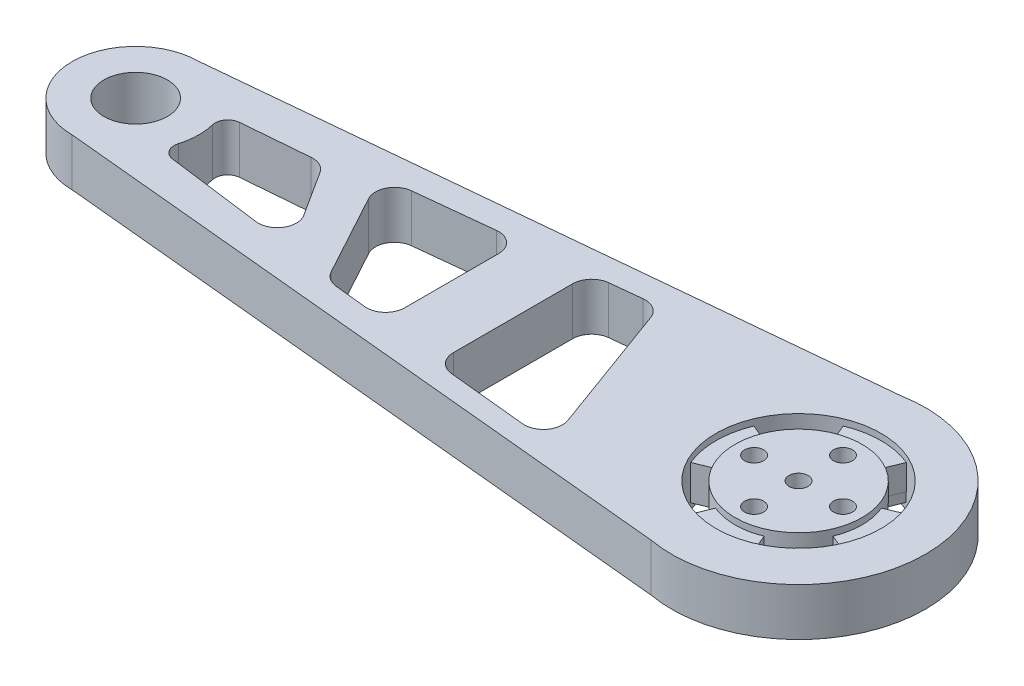
from build123d import *
from build123d.topology import SkipClean

# Parameters (mm, degrees)
EXTRUDE_1_DEPTH          = 47
EXTRUDE_1_DEPTH_BACK     = 57
EXTRUDE_2_DEPTH          = 3.75
EXTRUDE_2_DEPTH_BACK     = 3.75
SKETCH_2_R               = 20
CUT_EXTRUDE_1_DEPTH      = 3.75
CUT_EXTRUDE_1_DEPTH_BACK = 3.75
SKETCH_3_R               = 1.5
CUT_EXTRUDE_START        = -1
CUT_EXTRUDE_2_DEPTH      = 1
SKETCH_5_R               = 1.5
CUT_EXTRUDE_3_DEPTH      = 2.5
EXTRUDE_START            = 1.5
EXTRUDE_3_DEPTH          = 1.5
EXTRUDE_4_DEPTH          = 3.75
EXTRUDE_4_DEPTH_BACK     = 3.75
SKETCH_7_R               = 10
SKETCH_7_R_2             = 5
CUT_EXTRUDE_4_DEPTH      = 3.75
CUT_EXTRUDE_4_DEPTH_BACK = 3.75
SKETCH_8_R               = 5
EXTRUDE_5_DEPTH          = 3.75
EXTRUDE_5_DEPTH_BACK     = 3.75
CUT_EXTRUDE_5_DEPTH      = 3.75
CUT_EXTRUDE_5_DEPTH_BACK = 3.75


with BuildPart() as part:
    # 草图1 → 凸台-拉伸1 (new, two sides: drawn at the far end of the back side and taken through both)
    with BuildSketch(Plane(origin=(0, 0, 0), x_dir=(0, 0, -1), z_dir=(1, 0, 0)).offset(-EXTRUDE_1_DEPTH_BACK)):
        Polygon((10, 0), (10, 3.75), (-10, 3.75), (-10, -3.75), (10, -3.75), align=None)
    extrude(amount=EXTRUDE_1_DEPTH + EXTRUDE_1_DEPTH_BACK)

    # 草图2 → 凸台-拉伸2 (add, two sides: drawn at the far end of the back side and taken through both)
    with BuildSketch(Plane(origin=(0, 0, 0), x_dir=(1, 0, 0), z_dir=(0, 1, 0)).offset(-EXTRUDE_2_DEPTH_BACK)):
        with Locations((47.397956018, 0)):
            Circle(SKETCH_2_R)
    extrude(amount=EXTRUDE_2_DEPTH + EXTRUDE_2_DEPTH_BACK)

    # 草图3 → 切除-拉伸1 (cut, two sides: drawn at the far end of the back side and taken through both)
    with BuildSketch(Plane(origin=(0, 0, 0), x_dir=(1, 0, 0), z_dir=(0, 1, 0)).offset(-CUT_EXTRUDE_1_DEPTH_BACK)):
        with BuildLine():
            ThreePointArc((52.372840639, -12.010433923), (56.590344173, -9.192388155), (59.408389941, -4.974884621))
            Line((59.408389941, -4.974884621), (56.636751343, -3.826834324))
            ThreePointArc((56.636751343, -3.826834324), (54.46902383, -7.071067812), (51.224790342, -9.238795325))
            Line((51.224790342, -9.238795325), (52.372840639, -12.010433923))
        make_face()
        with BuildLine():
            ThreePointArc((35.387522095, -4.974884621), (38.205567863, -9.192388155), (42.423071397, -12.010433923))
            Line((42.423071397, -12.010433923), (43.571121694, -9.238795325))
            ThreePointArc((43.571121694, -9.238795325), (40.326888206, -7.071067812), (38.159160693, -3.826834324))
            Line((38.159160693, -3.826834324), (35.387522095, -4.974884621))
        make_face()
        with BuildLine():
            Line((56.636751343, 3.826834324), (59.408389941, 4.974884621))
            ThreePointArc((59.408389941, 4.974884621), (56.590344173, 9.192388155), (52.372840639, 12.010433923))
            Line((52.372840639, 12.010433923), (51.224790342, 9.238795325))
            ThreePointArc((51.224790342, 9.238795325), (54.46902383, 7.071067812), (56.636751343, 3.826834324))
        make_face()
        with BuildLine():
            ThreePointArc((42.423071397, 12.010433923), (38.205567863, 9.192388155), (35.387522095, 4.974884621))
            Line((35.387522095, 4.974884621), (38.159160693, 3.826834324))
            ThreePointArc((38.159160693, 3.826834324), (40.326888206, 7.071067812), (43.571121694, 9.238795325))
            Line((43.571121694, 9.238795325), (42.423071397, 12.010433923))
        make_face()
        with Locations((47.397956018, 7)):
            Circle(SKETCH_3_R)
        with Locations((47.397956018, 0)):
            Circle(SKETCH_3_R)
        with Locations((54.397956018, 0)):
            Circle(SKETCH_3_R)
        with Locations((47.397956018, -7)):
            Circle(SKETCH_3_R)
        with Locations((40.397956018, 0)):
            Circle(SKETCH_3_R)
    extrude(amount=CUT_EXTRUDE_1_DEPTH + CUT_EXTRUDE_1_DEPTH_BACK, mode=Mode.SUBTRACT)

    # 草图4 → 切除-拉伸2 (cut)
    with SkipClean():  # the faces are left unmerged after this step: merging them gives an invalid solid
        with BuildSketch(Plane(origin=(0, 3.75, 0), x_dir=(1, 0, 0), z_dir=(0, 1, 0)).offset(CUT_EXTRUDE_START)):
            with BuildLine():
                Line((43.571121694, 9.238795325), (42.423071397, 12.010433923))
                ThreePointArc((42.423071397, 12.010433923), (47.397956018, 13), (52.372840639, 12.010433923))
                Line((52.372840639, 12.010433923), (51.224790342, 9.238795325))
                ThreePointArc((51.224790342, 9.238795325), (47.397956018, 10), (43.571121694, 9.238795325))
            make_face()
            with BuildLine():
                Line((56.636751343, 3.826834324), (59.408389941, 4.974884621))
                ThreePointArc((59.408389941, 4.974884621), (60.397956018, 0), (59.408389941, -4.974884621))
                Line((59.408389941, -4.974884621), (56.636751343, -3.826834324))
                ThreePointArc((56.636751343, -3.826834324), (57.397956018, 0), (56.636751343, 3.826834324))
            make_face()
            with BuildLine():
                Line((51.224790342, -9.238795325), (52.372840639, -12.010433923))
                ThreePointArc((52.372840639, -12.010433923), (47.397956018, -13), (42.423071397, -12.010433923))
                Line((42.423071397, -12.010433923), (43.571121694, -9.238795325))
                ThreePointArc((43.571121694, -9.238795325), (47.397956018, -10), (51.224790342, -9.238795325))
            make_face()
            with BuildLine():
                Line((38.159160693, -3.826834324), (35.387522095, -4.974884621))
                ThreePointArc((35.387522095, -4.974884621), (34.397956018, 0), (35.387522095, 4.974884621))
                Line((35.387522095, 4.974884621), (38.159160693, 3.826834324))
                ThreePointArc((38.159160693, 3.826834324), (37.397956018, 0), (38.159160693, -3.826834324))
            make_face()
        extrude(amount=CUT_EXTRUDE_2_DEPTH, mode=Mode.SUBTRACT)

    # 草图5 → 切除-拉伸3 (cut)
    with SkipClean():  # the faces are left unmerged after this step: merging them gives an invalid solid
        with BuildSketch(Plane.XZ.offset(3.75)):
            with BuildLine():
                ThreePointArc((51.224790342, -9.238795325), (54.46902383, -7.071067812), (56.636751343, -3.826834324))
                Line((56.636751343, -3.826834324), (59.408389941, -4.974884621))
                ThreePointArc((59.408389941, -4.974884621), (60.397956018, 0), (59.408389941, 4.974884621))
                Line((59.408389941, 4.974884621), (56.636751343, 3.826834324))
                ThreePointArc((56.636751343, 3.826834324), (54.46902383, 7.071067812), (51.224790342, 9.238795325))
                Line((51.224790342, 9.238795325), (52.372840639, 12.010433923))
                ThreePointArc((52.372840639, 12.010433923), (47.397956018, 13), (42.423071397, 12.010433923))
                Line((42.423071397, 12.010433923), (43.571121694, 9.238795325))
                ThreePointArc((43.571121694, 9.238795325), (40.326888206, 7.071067812), (38.159160693, 3.826834324))
                Line((38.159160693, 3.826834324), (35.387522095, 4.974884621))
                ThreePointArc((35.387522095, 4.974884621), (34.397956018, 0), (35.387522095, -4.974884621))
                Line((35.387522095, -4.974884621), (38.159160693, -3.826834324))
                ThreePointArc((38.159160693, -3.826834324), (40.326888206, -7.071067812), (43.571121694, -9.238795325))
                Line((43.571121694, -9.238795325), (42.423071397, -12.010433923))
                ThreePointArc((42.423071397, -12.010433923), (47.397956018, -13), (52.372840639, -12.010433923))
                Line((52.372840639, -12.010433923), (51.224790342, -9.238795325))
            make_face()
            with Locations((47.397956018, -7)):
                Circle(SKETCH_5_R, mode=Mode.SUBTRACT)
            with Locations((54.397956018, 0)):
                Circle(SKETCH_5_R, mode=Mode.SUBTRACT)
            with Locations((40.397956018, 0)):
                Circle(SKETCH_5_R, mode=Mode.SUBTRACT)
            with Locations((47.397956018, 0)):
                Circle(SKETCH_5_R, mode=Mode.SUBTRACT)
            with Locations((47.397956018, 7)):
                Circle(SKETCH_5_R, mode=Mode.SUBTRACT)
        extrude(amount=-CUT_EXTRUDE_3_DEPTH, mode=Mode.SUBTRACT)

    # 草图6 → 凸台-拉伸3 (add)
    with SkipClean():  # the faces are left unmerged after this step: merging them gives an invalid solid
        with BuildSketch(Plane.XZ.offset(1.25).offset(EXTRUDE_START)):
            with BuildLine():
                Line((59.440760131, 4.896005422), (56.66165149, 3.766158017))
                ThreePointArc((56.66165149, 3.766158017), (57.397902247, -0.032793412), (56.636751343, -3.826834324))
                Line((56.636751343, -3.826834324), (59.408389941, -4.974884621))
                ThreePointArc((59.408389941, -4.974884621), (60.397886116, -0.042631436), (59.440760131, 4.896005422))
            make_face()
            with BuildLine():
                Line((42.501950596, 12.042804113), (43.631798001, 9.263695472))
                ThreePointArc((43.631798001, 9.263695472), (47.43074943, 9.999946229), (51.224790342, 9.238795325))
                Line((51.224790342, 9.238795325), (52.372840639, 12.010433923))
                ThreePointArc((52.372840639, 12.010433923), (47.440587454, 12.999930098), (42.501950596, 12.042804113))
            make_face()
            with BuildLine():
                Line((52.29396144, -12.042804113), (51.164114035, -9.263695472))
                ThreePointArc((51.164114035, -9.263695472), (47.365162606, -9.999946229), (43.571121694, -9.238795325))
                Line((43.571121694, -9.238795325), (42.423071397, -12.010433923))
                ThreePointArc((42.423071397, -12.010433923), (47.355324582, -12.999930098), (52.29396144, -12.042804113))
            make_face()
            with BuildLine():
                Line((35.355151905, -4.896005422), (38.134260546, -3.766158017))
                ThreePointArc((38.134260546, -3.766158017), (37.398009789, 0.032793412), (38.159160693, 3.826834324))
                Line((38.159160693, 3.826834324), (35.387522095, 4.974884621))
                ThreePointArc((35.387522095, 4.974884621), (34.39802592, 0.042631436), (35.355151905, -4.896005422))
            make_face()
        extrude(amount=-EXTRUDE_3_DEPTH)

    # 草图7 → 凸台-拉伸4 (add, two sides: drawn at the far end of the back side and taken through both)
    with SkipClean():  # the faces are left unmerged after this step: merging them gives an invalid solid
        with BuildSketch(Plane(origin=(0, 0, 0), x_dir=(1, 0, 0), z_dir=(0, 1, 0)).offset(-EXTRUDE_4_DEPTH_BACK)):
            with Locations((-57, 0)):
                Circle(SKETCH_7_R)
            with Locations((-57, 0)):
                Circle(SKETCH_7_R_2, mode=Mode.SUBTRACT)
        extrude(amount=EXTRUDE_4_DEPTH + EXTRUDE_4_DEPTH_BACK)

    # 草图8 → 切除-拉伸4 (cut, two sides: drawn at the far end of the back side and taken through both)
    with SkipClean():  # the faces are left unmerged after this step: merging them gives an invalid solid
        with BuildSketch(Plane(origin=(0, 0, 0), x_dir=(1, 0, 0), z_dir=(0, 1, 0)).offset(-CUT_EXTRUDE_4_DEPTH_BACK)):
            with Locations((-57, 0)):
                Circle(SKETCH_8_R)
        extrude(amount=CUT_EXTRUDE_4_DEPTH + CUT_EXTRUDE_4_DEPTH_BACK, mode=Mode.SUBTRACT)

    # 草图9 → 凸台-拉伸5 (add, two sides: drawn at the far end of the back side and taken through both)
    with SkipClean():  # the faces are left unmerged after this step: merging them gives an invalid solid
        with BuildSketch(Plane(origin=(0, 0, 0), x_dir=(1, 0, 0), z_dir=(0, 1, 0)).offset(-EXTRUDE_5_DEPTH_BACK)):
            with BuildLine():
                Line((-57, 10), (43.813925273, 19.676247702))
                ThreePointArc((43.813925273, 19.676247702), (35.88025754, 16.350615333), (30.077447942, 10))
                Line((30.077447942, 10), (-57, 10))
            make_face()
            with BuildLine():
                Line((-57, -10), (43.813925273, -19.676247702))
                ThreePointArc((43.813925273, -19.676247702), (35.88025754, -16.350615333), (30.077447942, -10))
                Line((30.077447942, -10), (-57, -10))
            make_face()
        extrude(amount=EXTRUDE_5_DEPTH + EXTRUDE_5_DEPTH_BACK)

    # 草图10 → 切除-拉伸5 (cut, two sides: drawn at the far end of the back side and taken through both)
    with BuildSketch(Plane(origin=(0, 0, 0), x_dir=(1, 0, 0), z_dir=(0, 1, 0)).offset(-CUT_EXTRUDE_5_DEPTH_BACK)):
        with BuildLine():
            Line((-17.9208659, -8.294738781), (-24.97116153, 4.678580119))
            ThreePointArc((-24.97116153, 4.678580119), (-24.991476986, 7.505496331), (-22.653103706, 9.094168225))
            Line((-22.653103706, 9.094168225), (-10.542995546, 10.384503445))
            ThreePointArc((-10.542995546, 10.384503445), (-8.219346695, 9.632258445), (-7.225143941, 7.40138924))
            Line((-7.225143941, 7.40138924), (-7.225143941, -7.40138924))
            ThreePointArc((-7.225143941, -7.40138924), (-8.219346695, -9.632258445), (-10.542995546, -10.384503445))
            Line((-10.542995546, -10.384503445), (-15.602808076, -9.845379085))
            ThreePointArc((-15.602808076, -9.845379085), (-16.952978473, -9.355797033), (-17.9208659, -8.294738781))
        make_face()
        with BuildLine():
            Line((-27.776054729, -2.760454133), (-32.346390661, 4.382586826))
            ThreePointArc((-32.346390661, 4.382586826), (-33.54406848, 5.455130866), (-35.123527565, 5.75528395))
            Line((-35.123527565, 5.75528395), (-45.542835136, 4.883527321))
            ThreePointArc((-45.542835136, 4.883527321), (-47.001745989, 4.055488699), (-47.316974898, 2.407854161))
            ThreePointArc((-47.316974898, 2.407854161), (-47.024652941, -0.226247319), (-47.436099119, -2.844386882))
            ThreePointArc((-47.436099119, -2.844386882), (-47.195894764, -4.504619006), (-45.776025692, -5.397950218))
            Line((-45.776025692, -5.397950218), (-30.688474759, -7.352451462))
            ThreePointArc((-30.688474759, -7.352451462), (-27.76964281, -5.984103471), (-27.776054729, -2.760454133))
        make_face()
        with BuildLine():
            Line((5.418334864, -12.681820506), (17.859683052, -13.933213319))
            ThreePointArc((17.859683052, -13.933213319), (20.528994281, -12.788785135), (20.977971059, -9.919402247))
            Line((20.977971059, -9.919402247), (13.466485556, 10.654346756))
            ThreePointArc((13.466485556, 10.654346756), (12.235101202, 12.171546469), (10.330581154, 12.60858855))
            Line((10.330581154, 12.60858855), (5.400718468, 12.08331038))
            ThreePointArc((5.400718468, 12.08331038), (3.487700869, 11.105993422), (2.718570074, 9.100196176))
            Line((2.718570074, 9.100196176), (2.718570074, -9.696881844))
            ThreePointArc((2.718570074, -9.696881844), (3.49363124, -11.709255364), (5.418334864, -12.681820506))
        make_face()
    extrude(amount=CUT_EXTRUDE_5_DEPTH + CUT_EXTRUDE_5_DEPTH_BACK, mode=Mode.SUBTRACT)


solid = part.part
